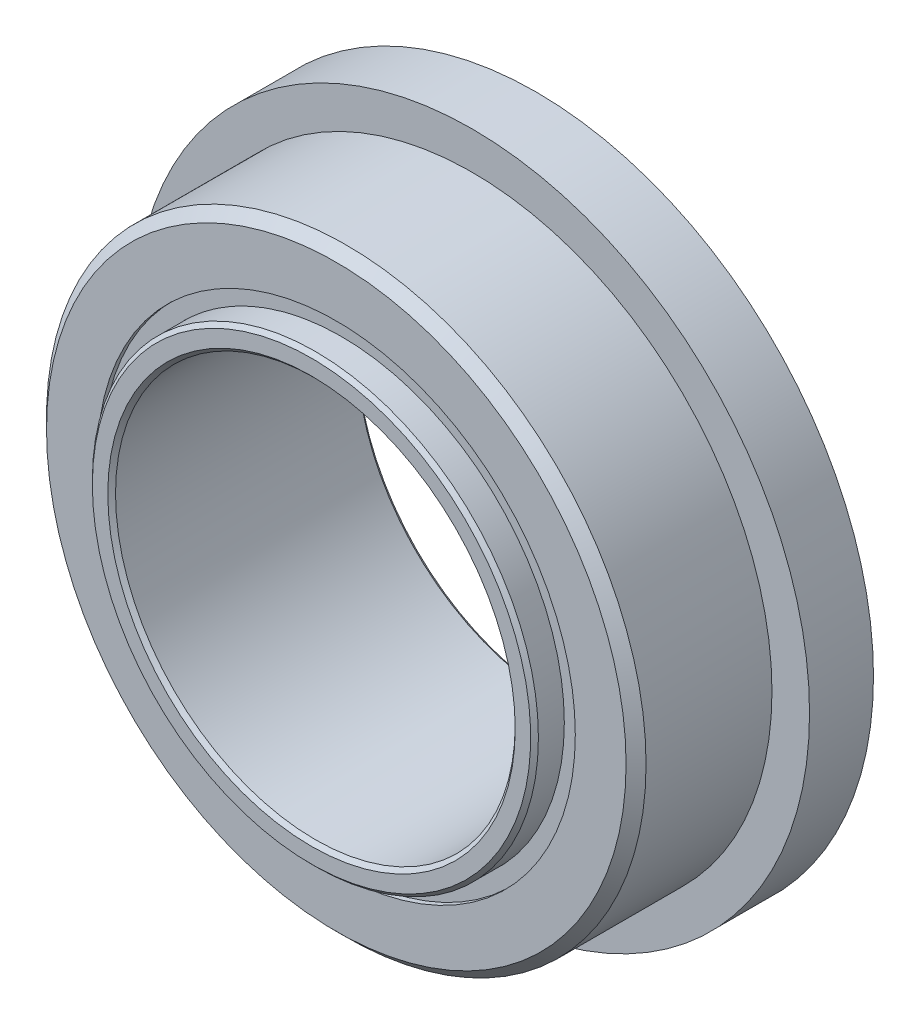
from build123d import *

# Parameters (mm, degrees)
CHAMFER1_SIZE     = 0.061383333
CIRPATTERN1_COUNT = 12
SKETCH5_W         = 0.978958333
SKETCH5_H         = 0.254
SKETCH6_W         = 1.016
SKETCH6_H         = 1.5621


with BuildPart() as part:
    # Sketch1 → Revolve1 (revolve)
    with BuildSketch(Plane(origin=(0, 0, 0), x_dir=(0, 0, -1), z_dir=(1, 0, 0)), mode=Mode.PRIVATE) as revolve1_sk:
        with BuildLine():
            Line((1.42875, 4.7625), (-1.42875, 4.7625))
            Line((-1.42875, 4.7625), (-1.5875, 4.60375))
            Line((-1.5875, 4.60375), (-1.5875, 3.7973))
            Line((-1.5875, 3.7973), (-0.521280469, 3.7973))
            ThreePointArc((-0.521280469, 3.7973), (0, 4.417483333), (0.521280469, 3.7973))
            Line((0.521280469, 3.7973), (1.5875, 3.7973))
            Line((1.5875, 3.7973), (1.5875, 4.60375))
            Line((1.5875, 4.60375), (1.42875, 4.7625))
        make_face()
        with BuildLine():
            Line((1.9812, 3.5433), (0.401224203, 3.5433))
            ThreePointArc((0.401224203, 3.5433), (0, 3.35915), (-0.401224203, 3.5433))
            Line((-0.401224203, 3.5433), (-1.9812, 3.5433))
            Line((-1.9812, 3.5433), (-1.9812, 3.175))
            Line((-1.9812, 3.175), (1.9812, 3.175))
            Line((1.9812, 3.175), (1.9812, 3.5433))
        make_face()
    revolve(revolve1_sk.sketch.rotate(Axis((0, 0, 1.5875), (0, 0, -1)), 90), axis=Axis((0, 0, 1.5875), (0, 0, -1)))

    # Chamfer1
    chamfer1_edges = [part.edges().sort_by_distance(p)[0] for p in [
        (-3.5433, 0, -1.9812),
        (-3.175, 0, -1.9812),
        (-3.175, 0, 1.9812),
        (-3.5433, 0, 1.9812),
    ]]
    chamfer(chamfer1_edges, length=CHAMFER1_SIZE)

    # Sketch6 → Revolve6 (revolve)
    with BuildSketch(Plane(origin=(0, 0, 0), x_dir=(0, 0, -1), z_dir=(1, 0, 0)), mode=Mode.PRIVATE) as revolve6_sk:
        with Locations((1.0795, 4.57835)):
            Rectangle(SKETCH6_W, SKETCH6_H)
    revolve(revolve6_sk.sketch.rotate(Axis((0, 0, -1.5875), (0, 0, 1)), 90), axis=Axis((0, 0, -1.5875), (0, 0, 1)))


with BuildPart() as body_2:
    # Sketch4 → Revolve4 (revolve)
    with BuildSketch(Plane(origin=(0, 0, 0), x_dir=(0, 0, -1), z_dir=(1, 0, 0))):
        with BuildLine():
            Line((-0.529166667, 3.888316667), (0.529166667, 3.888316667))
            ThreePointArc((0.529166667, 3.888316667), (0, 4.417483333), (-0.529166667, 3.888316667))
        make_face()
    revolve(axis=Axis((0, 3.888316667, 0.529166667), (0, 0, -1)))


with BuildPart() as cirpattern1_1:
    # CirPattern1: pattern copy
    add(body_2.part.rotate(Axis((0, 0, 0), (0, 0, 1)), 1 * 360 / CIRPATTERN1_COUNT))


with BuildPart() as cirpattern1_2:
    # CirPattern1: pattern copy
    add(body_2.part.rotate(Axis((0, 0, 0), (0, 0, 1)), 2 * 360 / CIRPATTERN1_COUNT))


with BuildPart() as cirpattern1_3:
    # CirPattern1: pattern copy
    add(body_2.part.rotate(Axis((0, 0, 0), (0, 0, 1)), 3 * 360 / CIRPATTERN1_COUNT))


with BuildPart() as cirpattern1_4:
    # CirPattern1: pattern copy
    add(body_2.part.rotate(Axis((0, 0, 0), (0, 0, 1)), 4 * 360 / CIRPATTERN1_COUNT))


with BuildPart() as cirpattern1_5:
    # CirPattern1: pattern copy
    add(body_2.part.rotate(Axis((0, 0, 0), (0, 0, 1)), 5 * 360 / CIRPATTERN1_COUNT))


with BuildPart() as cirpattern1_6:
    # CirPattern1: pattern copy
    add(body_2.part.rotate(Axis((0, 0, 0), (0, 0, 1)), 6 * 360 / CIRPATTERN1_COUNT))


with BuildPart() as cirpattern1_7:
    # CirPattern1: pattern copy
    add(body_2.part.rotate(Axis((0, 0, 0), (0, 0, 1)), 7 * 360 / CIRPATTERN1_COUNT))


with BuildPart() as cirpattern1_8:
    # CirPattern1: pattern copy
    add(body_2.part.rotate(Axis((0, 0, 0), (0, 0, 1)), 8 * 360 / CIRPATTERN1_COUNT))


with BuildPart() as cirpattern1_9:
    # CirPattern1: pattern copy
    add(body_2.part.rotate(Axis((0, 0, 0), (0, 0, 1)), 9 * 360 / CIRPATTERN1_COUNT))


with BuildPart() as cirpattern1_10:
    # CirPattern1: pattern copy
    add(body_2.part.rotate(Axis((0, 0, 0), (0, 0, 1)), 10 * 360 / CIRPATTERN1_COUNT))


with BuildPart() as cirpattern1_11:
    # CirPattern1: pattern copy
    add(body_2.part.rotate(Axis((0, 0, 0), (0, 0, 1)), 11 * 360 / CIRPATTERN1_COUNT))


with BuildPart() as body_14:
    # Sketch5 → Revolve5 (revolve)
    with BuildSketch(Plane(origin=(0, 0, 0), x_dir=(0, 0, -1), z_dir=(1, 0, 0)), mode=Mode.PRIVATE) as revolve5_sk:
        with Locations((-1.018645834, 3.6703)):
            Rectangle(SKETCH5_W, SKETCH5_H)
        with Locations((1.018645834, 3.6703)):
            Rectangle(SKETCH5_W, SKETCH5_H)
    revolve(revolve5_sk.sketch.rotate(Axis((0, 0, 1.5875), (0, 0, -1)), 90), axis=Axis((0, 0, 1.5875), (0, 0, -1)))


solid = Compound([part.part, body_2.part, cirpattern1_1.part, cirpattern1_2.part, cirpattern1_3.part, cirpattern1_4.part, cirpattern1_5.part, cirpattern1_6.part, cirpattern1_7.part, cirpattern1_8.part, cirpattern1_9.part, cirpattern1_10.part, cirpattern1_11.part, body_14.part])
